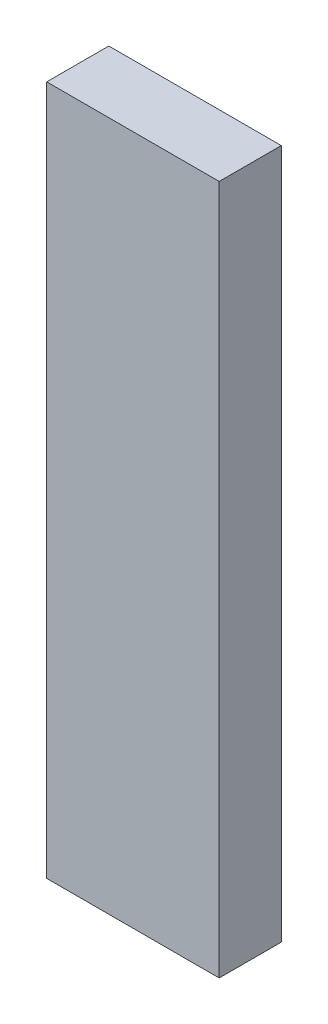
from build123d import *

# Parameters (mm, degrees)
SKETCH1_W           = 50
SKETCH1_H           = 200
BOSS_EXTRUDE1_DEPTH = 18


with BuildPart() as part:
    # Sketch1 → Boss-Extrude1 (new body)
    with BuildSketch(Plane.XY):
        with Locations((25, 100)):
            Rectangle(SKETCH1_W, SKETCH1_H)
    extrude(amount=BOSS_EXTRUDE1_DEPTH)


solid = part.part
